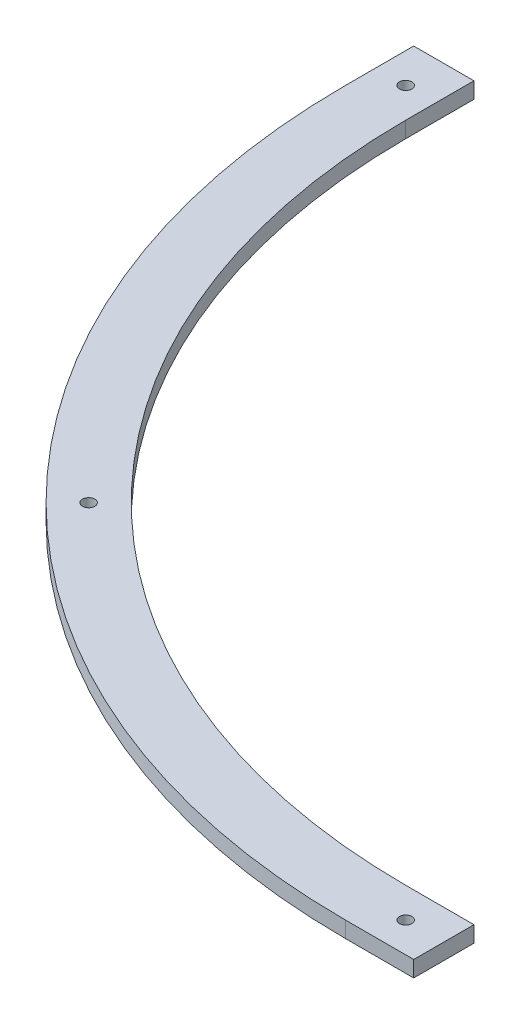
from build123d import *

# Parameters (mm, degrees)
SKETCH1_R           = 1.55
BOSS_EXTRUDE1_DEPTH = 4


with BuildPart() as part:
    # Sketch1 → Boss-Extrude1 (new body)
    with BuildSketch(Plane(origin=(0, 0, 0), x_dir=(1, 0, 0), z_dir=(0, 1, 0))):
        with BuildLine():
            Line((-90, 90), (-90, 107))
            Line((-90, 107), (-75, 107))
            Line((-75, 107), (-75, 90))
            ThreePointArc((-75, 90), (-26.672618896, -26.672618896), (90, -75))
            Line((90, -75), (107, -75))
            Line((107, -75), (107, -90))
            Line((107, -90), (90, -90))
            ThreePointArc((90, -90), (-37.279220614, -37.279220614), (-90, 90))
        make_face()
        with Locations(Location((-82.5, 97.5, 0), (0, 0, 270))):
            Circle(SKETCH1_R, mode=Mode.SUBTRACT)
        with Locations(Location((97.5, -82.5, 0), (0, 0, 270))):
            Circle(SKETCH1_R, mode=Mode.SUBTRACT)
        with Locations(Location((-31.975919755, -31.975919755, 0), (0, 0, 270))):
            Circle(SKETCH1_R, mode=Mode.SUBTRACT)
    extrude(amount=BOSS_EXTRUDE1_DEPTH)


solid = part.part
